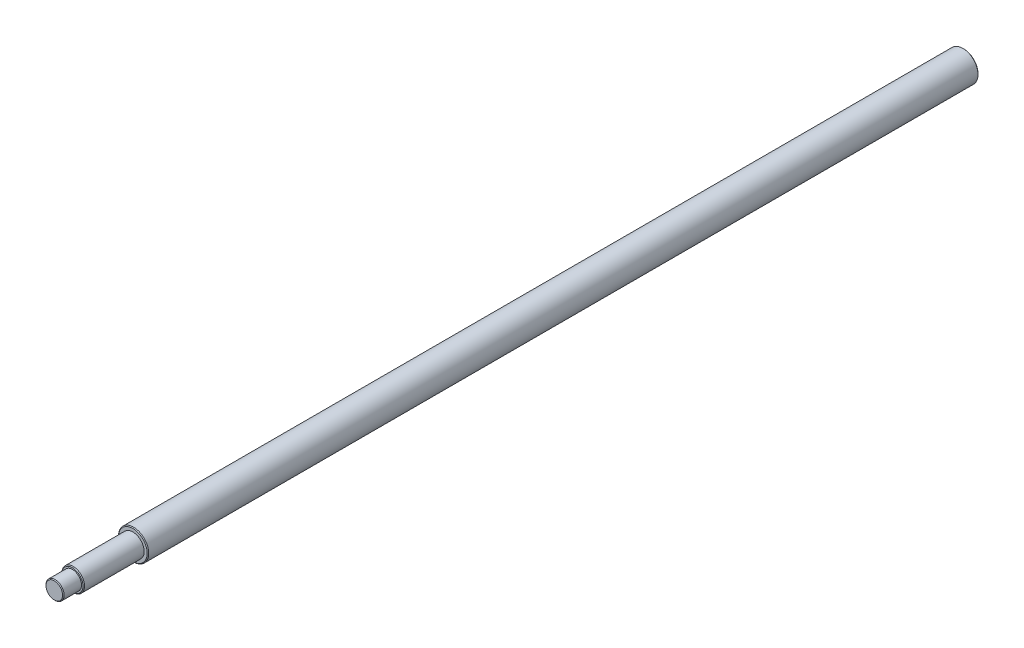
from build123d import *

# Parameters (mm, degrees)
SKETCH1_R           = 10
BOSS_EXTRUDE1_DEPTH = 550
SKETCH4_R           = 7.5
BOSS_EXTRUDE2_DEPTH = 40
SKETCH5_R           = 6
BOSS_EXTRUDE3_DEPTH = 12
CHAMFER1_SIZE       = 0.5


with BuildPart() as part:
    # Sketch1 → Boss-Extrude1 (new body)
    with BuildSketch(Plane.XY):
        Circle(SKETCH1_R)
    extrude(amount=BOSS_EXTRUDE1_DEPTH)

    # Sketch4 → Boss-Extrude2 (add)
    with BuildSketch(Plane.XY.offset(550)):
        Circle(SKETCH4_R)
    extrude(amount=BOSS_EXTRUDE2_DEPTH)

    # Sketch5 → Boss-Extrude3 (add)
    with BuildSketch(Plane.XY.offset(590)):
        Circle(SKETCH5_R)
    extrude(amount=BOSS_EXTRUDE3_DEPTH)

    # Chamfer1
    chamfer1_edges = [part.edges().sort_by_distance(p)[0] for p in [
        (-6, 0, 602),
        (-10, 0, 0),
        (-10, 0, 550),
        (-7.5, 0, 590),
    ]]
    chamfer(chamfer1_edges, length=CHAMFER1_SIZE)


solid = part.part
